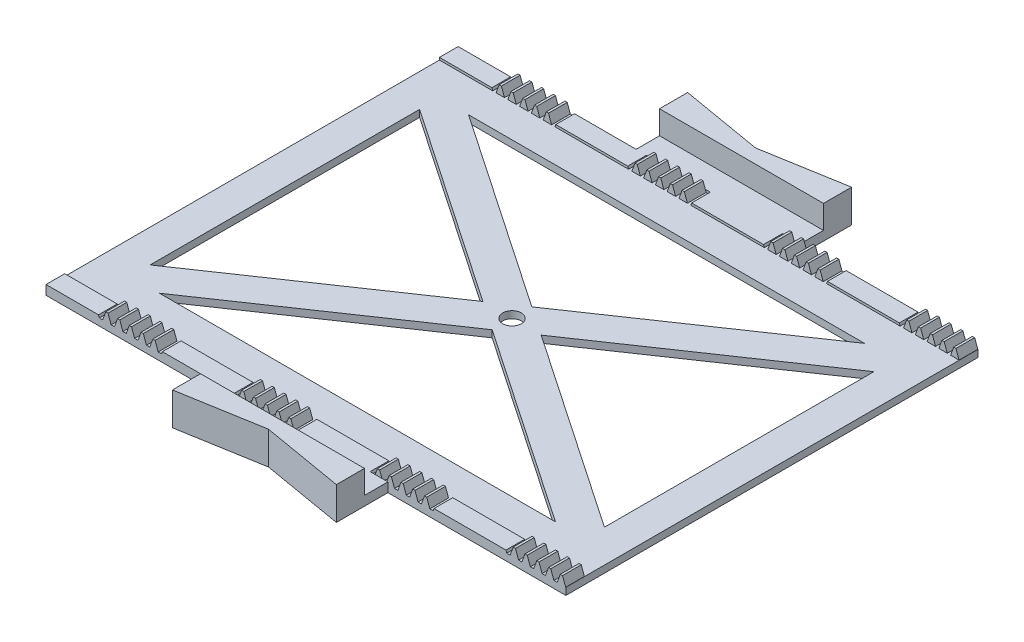
from build123d import *

# Parameters (mm, degrees)
BOSS_EXTRUDE1_DEPTH        = 2
SKETCH8_W                  = 12.566370614
SKETCH8_H                  = 1.3254
BOSS_EXTRUDE2_DEPTH        = 4
CUT_EXTRUDE1_DEPTH         = 4
LPATTERN1_COUNT            = 2
LPATTERN1_PITCH            = 2.513274123
LPATTERN1_COL_COUNT        = 5
LPATTERN1_COL_PITCH        = 2.513274123
MIRROR1_COPY_1_DEPTH       = 4
MIRROR1_COPY_2_DEPTH       = 4
MIRROR1_COPY_3_DEPTH       = 4
MIRROR1_COPY_4_DEPTH       = 4
MIRROR1_COPY_5_DEPTH       = 4
LPATTERN2_COUNT            = 4
LPATTERN2_PITCH            = 29
LPATTERN2_COPY_1_DEPTH     = 4
LPATTERN2_COPY_2_DEPTH     = 4
LPATTERN2_COPY_3_DEPTH     = 4
LPATTERN2_COPY_4_DEPTH     = 4
LPATTERN2_COPY_5_DEPTH     = 4
LPATTERN2_COPY_6_DEPTH     = 4
LPATTERN2_COPY_7_DEPTH     = 4
LPATTERN2_COPY_8_DEPTH     = 4
LPATTERN2_COPY_9_DEPTH     = 4
LPATTERN2_COPY_10_DEPTH    = 4
LPATTERN2_COPY_11_DEPTH    = 4
LPATTERN2_COPY_12_DEPTH    = 4
LPATTERN2_COPY_13_DEPTH    = 4
LPATTERN2_COPY_14_DEPTH    = 4
LPATTERN2_COPY_15_DEPTH    = 4
LPATTERN2_COPY_16_SKETCH_W = 12.566370614
LPATTERN2_COPY_16_SKETCH_H = 1.3254
LPATTERN2_COPY_16_DEPTH    = 4
LPATTERN2_COPY_17_SKETCH_W = 12.566370614
LPATTERN2_COPY_17_SKETCH_H = 1.3254
LPATTERN2_COPY_17_DEPTH    = 4
LPATTERN2_COPY_18_SKETCH_W = 12.566370614
LPATTERN2_COPY_18_SKETCH_H = 1.3254
LPATTERN2_COPY_18_DEPTH    = 4
LPATTERN2_COPY_19_DEPTH    = 4
LPATTERN2_COPY_20_DEPTH    = 4
LPATTERN2_COPY_21_DEPTH    = 4
LPATTERN2_COPY_22_DEPTH    = 4
LPATTERN2_COPY_23_DEPTH    = 4
LPATTERN2_COPY_24_DEPTH    = 4
LPATTERN2_COPY_25_DEPTH    = 4
LPATTERN2_COPY_26_DEPTH    = 4
LPATTERN2_COPY_27_DEPTH    = 4
LPATTERN2_COPY_28_DEPTH    = 4
LPATTERN2_COPY_29_DEPTH    = 4
LPATTERN2_COPY_30_DEPTH    = 4
LPATTERN2_COPY_31_DEPTH    = 4
LPATTERN2_COPY_32_DEPTH    = 4
LPATTERN2_COPY_33_DEPTH    = 4
LPATTERN2_COPY_34_DEPTH    = 4
LPATTERN2_COPY_35_DEPTH    = 4
LPATTERN2_COPY_36_DEPTH    = 4
SKETCH9_W                  = 111
SKETCH9_H                  = 80
CUT_EXTRUDE2_DEPTH         = 0.5
SKETCH10_R                 = 2
CUT_EXTRUDE3_DEPTH         = 75.05796436
BOSS_EXTRUDE3_DEPTH        = 7
SKETCH13_R                 = 4
CUT_EXTRUDE4_DEPTH         = 1
MIRROR4_COPY_1_SKETCH_R    = 4
MIRROR4_COPY_1_DEPTH       = 1


with BuildPart() as part:
    # Sketch1 → Boss-Extrude1 (new body)
    with BuildSketch(Plane(origin=(0, 0, 0), x_dir=(1, 0, 0), z_dir=(0, 1, 0))):
        Polygon((-17.5, -49), (-17.5, -44), (-55.5, -44), (-55.5, 44), (-17.5, 44), (-17.5, 49), (17.5, 49), (17.5, 44), (55.5, 44), (55.5, -44), (17.5, -44), (17.5, -49), align=None)
    extrude(amount=BOSS_EXTRUDE1_DEPTH)

    # Sketch8 → Boss-Extrude2 (add)
    with BuildSketch(Plane.XY.offset(44)):
        with Locations((49.526548246, 2.6627)):
            Rectangle(SKETCH8_W, SKETCH8_H)
    boss_extrude2 = extrude(amount=-BOSS_EXTRUDE2_DEPTH)

    # Sketch7 → Cut-Extrude1 (cut)
    with BuildSketch(Plane.XY.offset(44)):
        Polygon((46.110985357, 1.5), (45.402288766, 1.5), (44.7378975, 3.3254), (46.775376623, 3.3254), align=None)
    cut_extrude1 = extrude(amount=-CUT_EXTRUDE1_DEPTH, mode=Mode.SUBTRACT)

    # LPattern1: Cut-Extrude1 ×2
    with Locations(*[(-i * LPATTERN1_PITCH, 0, 0) for i in range(1, LPATTERN1_COUNT)]):
        add(cut_extrude1, mode=Mode.SUBTRACT)

    # LPattern1 col: Cut-Extrude1 ×5
    with Locations(*[(i * LPATTERN1_COL_PITCH, 0, 0) for i in range(1, LPATTERN1_COL_COUNT)]):
        add(cut_extrude1, mode=Mode.SUBTRACT)

    # Mirror1: Boss-Extrude2, Cut-Extrude1 across plane
    add(boss_extrude2.mirror(Plane.XY))
    add(cut_extrude1.mirror(Plane.XY), mode=Mode.SUBTRACT)

    # Mirror1 copy 1 sketch → Mirror1 copy 1 (cut)
    with BuildSketch(Plane(origin=(-2.513274123, 0, -44), x_dir=(1, 0, 0), z_dir=(0, 0, -1))):
        Polygon((46.110985357, -1.5), (45.402288766, -1.5), (44.7378975, -3.3254), (46.775376623, -3.3254), align=None)
    extrude(amount=-MIRROR1_COPY_1_DEPTH, mode=Mode.SUBTRACT)

    # Mirror1 copy 2 sketch → Mirror1 copy 2 (cut)
    with BuildSketch(Plane(origin=(2.513274123, 0, -44), x_dir=(1, 0, 0), z_dir=(0, 0, -1))):
        Polygon((46.110985357, -1.5), (45.402288766, -1.5), (44.7378975, -3.3254), (46.775376623, -3.3254), align=None)
    extrude(amount=-MIRROR1_COPY_2_DEPTH, mode=Mode.SUBTRACT)

    # Mirror1 copy 3 sketch → Mirror1 copy 3 (cut)
    with BuildSketch(Plane(origin=(5.026548246, 0, -44), x_dir=(1, 0, 0), z_dir=(0, 0, -1))):
        Polygon((46.110985357, -1.5), (45.402288766, -1.5), (44.7378975, -3.3254), (46.775376623, -3.3254), align=None)
    extrude(amount=-MIRROR1_COPY_3_DEPTH, mode=Mode.SUBTRACT)

    # Mirror1 copy 4 sketch → Mirror1 copy 4 (cut)
    with BuildSketch(Plane(origin=(7.539822369, 0, -44), x_dir=(1, 0, 0), z_dir=(0, 0, -1))):
        Polygon((46.110985357, -1.5), (45.402288766, -1.5), (44.7378975, -3.3254), (46.775376623, -3.3254), align=None)
    extrude(amount=-MIRROR1_COPY_4_DEPTH, mode=Mode.SUBTRACT)

    # Mirror1 copy 5 sketch → Mirror1 copy 5 (cut)
    with BuildSketch(Plane(origin=(10.053096491, 0, -44), x_dir=(1, 0, 0), z_dir=(0, 0, -1))):
        Polygon((46.110985357, -1.5), (45.402288766, -1.5), (44.7378975, -3.3254), (46.775376623, -3.3254), align=None)
    extrude(amount=-MIRROR1_COPY_5_DEPTH, mode=Mode.SUBTRACT)

    # LPattern2: Boss-Extrude2, Cut-Extrude1 ×4
    with Locations(*[(-i * LPATTERN2_PITCH, 0, 0) for i in range(1, LPATTERN2_COUNT)]):
        add(boss_extrude2)
        add(cut_extrude1, mode=Mode.SUBTRACT)

    # LPattern2 copy 1 sketch → LPattern2 copy 1 (cut)
    with BuildSketch(Plane(origin=(-31.513274123, 0, 44), x_dir=(1, 0, 0), z_dir=(0, 0, 1))):
        Polygon((46.110985357, 1.5), (45.402288766, 1.5), (44.7378975, 3.3254), (46.775376623, 3.3254), align=None)
    extrude(amount=-LPATTERN2_COPY_1_DEPTH, mode=Mode.SUBTRACT)

    # LPattern2 copy 2 sketch → LPattern2 copy 2 (cut)
    with BuildSketch(Plane(origin=(-60.513274123, 0, 44), x_dir=(1, 0, 0), z_dir=(0, 0, 1))):
        Polygon((46.110985357, 1.5), (45.402288766, 1.5), (44.7378975, 3.3254), (46.775376623, 3.3254), align=None)
    extrude(amount=-LPATTERN2_COPY_2_DEPTH, mode=Mode.SUBTRACT)

    # LPattern2 copy 3 sketch → LPattern2 copy 3 (cut)
    with BuildSketch(Plane(origin=(-89.513274123, 0, 44), x_dir=(1, 0, 0), z_dir=(0, 0, 1))):
        Polygon((46.110985357, 1.5), (45.402288766, 1.5), (44.7378975, 3.3254), (46.775376623, 3.3254), align=None)
    extrude(amount=-LPATTERN2_COPY_3_DEPTH, mode=Mode.SUBTRACT)

    # LPattern2 copy 4 sketch → LPattern2 copy 4 (cut)
    with BuildSketch(Plane(origin=(-26.486725877, 0, 44), x_dir=(1, 0, 0), z_dir=(0, 0, 1))):
        Polygon((46.110985357, 1.5), (45.402288766, 1.5), (44.7378975, 3.3254), (46.775376623, 3.3254), align=None)
    extrude(amount=-LPATTERN2_COPY_4_DEPTH, mode=Mode.SUBTRACT)

    # LPattern2 copy 5 sketch → LPattern2 copy 5 (cut)
    with BuildSketch(Plane(origin=(-55.486725877, 0, 44), x_dir=(1, 0, 0), z_dir=(0, 0, 1))):
        Polygon((46.110985357, 1.5), (45.402288766, 1.5), (44.7378975, 3.3254), (46.775376623, 3.3254), align=None)
    extrude(amount=-LPATTERN2_COPY_5_DEPTH, mode=Mode.SUBTRACT)

    # LPattern2 copy 6 sketch → LPattern2 copy 6 (cut)
    with BuildSketch(Plane(origin=(-84.486725877, 0, 44), x_dir=(1, 0, 0), z_dir=(0, 0, 1))):
        Polygon((46.110985357, 1.5), (45.402288766, 1.5), (44.7378975, 3.3254), (46.775376623, 3.3254), align=None)
    extrude(amount=-LPATTERN2_COPY_6_DEPTH, mode=Mode.SUBTRACT)

    # LPattern2 copy 7 sketch → LPattern2 copy 7 (cut)
    with BuildSketch(Plane(origin=(-23.973451754, 0, 44), x_dir=(1, 0, 0), z_dir=(0, 0, 1))):
        Polygon((46.110985357, 1.5), (45.402288766, 1.5), (44.7378975, 3.3254), (46.775376623, 3.3254), align=None)
    extrude(amount=-LPATTERN2_COPY_7_DEPTH, mode=Mode.SUBTRACT)

    # LPattern2 copy 8 sketch → LPattern2 copy 8 (cut)
    with BuildSketch(Plane(origin=(-52.973451754, 0, 44), x_dir=(1, 0, 0), z_dir=(0, 0, 1))):
        Polygon((46.110985357, 1.5), (45.402288766, 1.5), (44.7378975, 3.3254), (46.775376623, 3.3254), align=None)
    extrude(amount=-LPATTERN2_COPY_8_DEPTH, mode=Mode.SUBTRACT)

    # LPattern2 copy 9 sketch → LPattern2 copy 9 (cut)
    with BuildSketch(Plane(origin=(-81.973451754, 0, 44), x_dir=(1, 0, 0), z_dir=(0, 0, 1))):
        Polygon((46.110985357, 1.5), (45.402288766, 1.5), (44.7378975, 3.3254), (46.775376623, 3.3254), align=None)
    extrude(amount=-LPATTERN2_COPY_9_DEPTH, mode=Mode.SUBTRACT)

    # LPattern2 copy 10 sketch → LPattern2 copy 10 (cut)
    with BuildSketch(Plane(origin=(-21.460177631, 0, 44), x_dir=(1, 0, 0), z_dir=(0, 0, 1))):
        Polygon((46.110985357, 1.5), (45.402288766, 1.5), (44.7378975, 3.3254), (46.775376623, 3.3254), align=None)
    extrude(amount=-LPATTERN2_COPY_10_DEPTH, mode=Mode.SUBTRACT)

    # LPattern2 copy 11 sketch → LPattern2 copy 11 (cut)
    with BuildSketch(Plane(origin=(-50.460177631, 0, 44), x_dir=(1, 0, 0), z_dir=(0, 0, 1))):
        Polygon((46.110985357, 1.5), (45.402288766, 1.5), (44.7378975, 3.3254), (46.775376623, 3.3254), align=None)
    extrude(amount=-LPATTERN2_COPY_11_DEPTH, mode=Mode.SUBTRACT)

    # LPattern2 copy 12 sketch → LPattern2 copy 12 (cut)
    with BuildSketch(Plane(origin=(-79.460177631, 0, 44), x_dir=(1, 0, 0), z_dir=(0, 0, 1))):
        Polygon((46.110985357, 1.5), (45.402288766, 1.5), (44.7378975, 3.3254), (46.775376623, 3.3254), align=None)
    extrude(amount=-LPATTERN2_COPY_12_DEPTH, mode=Mode.SUBTRACT)

    # LPattern2 copy 13 sketch → LPattern2 copy 13 (cut)
    with BuildSketch(Plane(origin=(-18.946903509, 0, 44), x_dir=(1, 0, 0), z_dir=(0, 0, 1))):
        Polygon((46.110985357, 1.5), (45.402288766, 1.5), (44.7378975, 3.3254), (46.775376623, 3.3254), align=None)
    extrude(amount=-LPATTERN2_COPY_13_DEPTH, mode=Mode.SUBTRACT)

    # LPattern2 copy 14 sketch → LPattern2 copy 14 (cut)
    with BuildSketch(Plane(origin=(-47.946903509, 0, 44), x_dir=(1, 0, 0), z_dir=(0, 0, 1))):
        Polygon((46.110985357, 1.5), (45.402288766, 1.5), (44.7378975, 3.3254), (46.775376623, 3.3254), align=None)
    extrude(amount=-LPATTERN2_COPY_14_DEPTH, mode=Mode.SUBTRACT)

    # LPattern2 copy 15 sketch → LPattern2 copy 15 (cut)
    with BuildSketch(Plane(origin=(-76.946903509, 0, 44), x_dir=(1, 0, 0), z_dir=(0, 0, 1))):
        Polygon((46.110985357, 1.5), (45.402288766, 1.5), (44.7378975, 3.3254), (46.775376623, 3.3254), align=None)
    extrude(amount=-LPATTERN2_COPY_15_DEPTH, mode=Mode.SUBTRACT)

    # LPattern2 copy 16 sketch → LPattern2 copy 16 (add)
    with BuildSketch(Plane(origin=(-29, 0, -44), x_dir=(1, 0, 0), z_dir=(0, 0, -1))):
        with Locations((49.526548246, -2.6627)):
            Rectangle(LPATTERN2_COPY_16_SKETCH_W, LPATTERN2_COPY_16_SKETCH_H)
    extrude(amount=-LPATTERN2_COPY_16_DEPTH)

    # LPattern2 copy 17 sketch → LPattern2 copy 17 (add)
    with BuildSketch(Plane(origin=(-58, 0, -44), x_dir=(1, 0, 0), z_dir=(0, 0, -1))):
        with Locations((49.526548246, -2.6627)):
            Rectangle(LPATTERN2_COPY_17_SKETCH_W, LPATTERN2_COPY_17_SKETCH_H)
    extrude(amount=-LPATTERN2_COPY_17_DEPTH)

    # LPattern2 copy 18 sketch → LPattern2 copy 18 (add)
    with BuildSketch(Plane(origin=(-87, 0, -44), x_dir=(1, 0, 0), z_dir=(0, 0, -1))):
        with Locations((49.526548246, -2.6627)):
            Rectangle(LPATTERN2_COPY_18_SKETCH_W, LPATTERN2_COPY_18_SKETCH_H)
    extrude(amount=-LPATTERN2_COPY_18_DEPTH)

    # LPattern2 copy 19 sketch → LPattern2 copy 19 (cut)
    with BuildSketch(Plane(origin=(-29, 0, -44), x_dir=(1, 0, 0), z_dir=(0, 0, -1))):
        Polygon((46.110985357, -1.5), (45.402288766, -1.5), (44.7378975, -3.3254), (46.775376623, -3.3254), align=None)
    extrude(amount=-LPATTERN2_COPY_19_DEPTH, mode=Mode.SUBTRACT)

    # LPattern2 copy 20 sketch → LPattern2 copy 20 (cut)
    with BuildSketch(Plane(origin=(-58, 0, -44), x_dir=(1, 0, 0), z_dir=(0, 0, -1))):
        Polygon((46.110985357, -1.5), (45.402288766, -1.5), (44.7378975, -3.3254), (46.775376623, -3.3254), align=None)
    extrude(amount=-LPATTERN2_COPY_20_DEPTH, mode=Mode.SUBTRACT)

    # LPattern2 copy 21 sketch → LPattern2 copy 21 (cut)
    with BuildSketch(Plane(origin=(-87, 0, -44), x_dir=(1, 0, 0), z_dir=(0, 0, -1))):
        Polygon((46.110985357, -1.5), (45.402288766, -1.5), (44.7378975, -3.3254), (46.775376623, -3.3254), align=None)
    extrude(amount=-LPATTERN2_COPY_21_DEPTH, mode=Mode.SUBTRACT)

    # LPattern2 copy 22 sketch → LPattern2 copy 22 (cut)
    with BuildSketch(Plane(origin=(-31.513274123, 0, -44), x_dir=(1, 0, 0), z_dir=(0, 0, -1))):
        Polygon((46.110985357, -1.5), (45.402288766, -1.5), (44.7378975, -3.3254), (46.775376623, -3.3254), align=None)
    extrude(amount=-LPATTERN2_COPY_22_DEPTH, mode=Mode.SUBTRACT)

    # LPattern2 copy 23 sketch → LPattern2 copy 23 (cut)
    with BuildSketch(Plane(origin=(-60.513274123, 0, -44), x_dir=(1, 0, 0), z_dir=(0, 0, -1))):
        Polygon((46.110985357, -1.5), (45.402288766, -1.5), (44.7378975, -3.3254), (46.775376623, -3.3254), align=None)
    extrude(amount=-LPATTERN2_COPY_23_DEPTH, mode=Mode.SUBTRACT)

    # LPattern2 copy 24 sketch → LPattern2 copy 24 (cut)
    with BuildSketch(Plane(origin=(-89.513274123, 0, -44), x_dir=(1, 0, 0), z_dir=(0, 0, -1))):
        Polygon((46.110985357, -1.5), (45.402288766, -1.5), (44.7378975, -3.3254), (46.775376623, -3.3254), align=None)
    extrude(amount=-LPATTERN2_COPY_24_DEPTH, mode=Mode.SUBTRACT)

    # LPattern2 copy 25 sketch → LPattern2 copy 25 (cut)
    with BuildSketch(Plane(origin=(-26.486725877, 0, -44), x_dir=(1, 0, 0), z_dir=(0, 0, -1))):
        Polygon((46.110985357, -1.5), (45.402288766, -1.5), (44.7378975, -3.3254), (46.775376623, -3.3254), align=None)
    extrude(amount=-LPATTERN2_COPY_25_DEPTH, mode=Mode.SUBTRACT)

    # LPattern2 copy 26 sketch → LPattern2 copy 26 (cut)
    with BuildSketch(Plane(origin=(-55.486725877, 0, -44), x_dir=(1, 0, 0), z_dir=(0, 0, -1))):
        Polygon((46.110985357, -1.5), (45.402288766, -1.5), (44.7378975, -3.3254), (46.775376623, -3.3254), align=None)
    extrude(amount=-LPATTERN2_COPY_26_DEPTH, mode=Mode.SUBTRACT)

    # LPattern2 copy 27 sketch → LPattern2 copy 27 (cut)
    with BuildSketch(Plane(origin=(-84.486725877, 0, -44), x_dir=(1, 0, 0), z_dir=(0, 0, -1))):
        Polygon((46.110985357, -1.5), (45.402288766, -1.5), (44.7378975, -3.3254), (46.775376623, -3.3254), align=None)
    extrude(amount=-LPATTERN2_COPY_27_DEPTH, mode=Mode.SUBTRACT)

    # LPattern2 copy 28 sketch → LPattern2 copy 28 (cut)
    with BuildSketch(Plane(origin=(-23.973451754, 0, -44), x_dir=(1, 0, 0), z_dir=(0, 0, -1))):
        Polygon((46.110985357, -1.5), (45.402288766, -1.5), (44.7378975, -3.3254), (46.775376623, -3.3254), align=None)
    extrude(amount=-LPATTERN2_COPY_28_DEPTH, mode=Mode.SUBTRACT)

    # LPattern2 copy 29 sketch → LPattern2 copy 29 (cut)
    with BuildSketch(Plane(origin=(-52.973451754, 0, -44), x_dir=(1, 0, 0), z_dir=(0, 0, -1))):
        Polygon((46.110985357, -1.5), (45.402288766, -1.5), (44.7378975, -3.3254), (46.775376623, -3.3254), align=None)
    extrude(amount=-LPATTERN2_COPY_29_DEPTH, mode=Mode.SUBTRACT)

    # LPattern2 copy 30 sketch → LPattern2 copy 30 (cut)
    with BuildSketch(Plane(origin=(-81.973451754, 0, -44), x_dir=(1, 0, 0), z_dir=(0, 0, -1))):
        Polygon((46.110985357, -1.5), (45.402288766, -1.5), (44.7378975, -3.3254), (46.775376623, -3.3254), align=None)
    extrude(amount=-LPATTERN2_COPY_30_DEPTH, mode=Mode.SUBTRACT)

    # LPattern2 copy 31 sketch → LPattern2 copy 31 (cut)
    with BuildSketch(Plane(origin=(-21.460177631, 0, -44), x_dir=(1, 0, 0), z_dir=(0, 0, -1))):
        Polygon((46.110985357, -1.5), (45.402288766, -1.5), (44.7378975, -3.3254), (46.775376623, -3.3254), align=None)
    extrude(amount=-LPATTERN2_COPY_31_DEPTH, mode=Mode.SUBTRACT)

    # LPattern2 copy 32 sketch → LPattern2 copy 32 (cut)
    with BuildSketch(Plane(origin=(-50.460177631, 0, -44), x_dir=(1, 0, 0), z_dir=(0, 0, -1))):
        Polygon((46.110985357, -1.5), (45.402288766, -1.5), (44.7378975, -3.3254), (46.775376623, -3.3254), align=None)
    extrude(amount=-LPATTERN2_COPY_32_DEPTH, mode=Mode.SUBTRACT)

    # LPattern2 copy 33 sketch → LPattern2 copy 33 (cut)
    with BuildSketch(Plane(origin=(-79.460177631, 0, -44), x_dir=(1, 0, 0), z_dir=(0, 0, -1))):
        Polygon((46.110985357, -1.5), (45.402288766, -1.5), (44.7378975, -3.3254), (46.775376623, -3.3254), align=None)
    extrude(amount=-LPATTERN2_COPY_33_DEPTH, mode=Mode.SUBTRACT)

    # LPattern2 copy 34 sketch → LPattern2 copy 34 (cut)
    with BuildSketch(Plane(origin=(-18.946903509, 0, -44), x_dir=(1, 0, 0), z_dir=(0, 0, -1))):
        Polygon((46.110985357, -1.5), (45.402288766, -1.5), (44.7378975, -3.3254), (46.775376623, -3.3254), align=None)
    extrude(amount=-LPATTERN2_COPY_34_DEPTH, mode=Mode.SUBTRACT)

    # LPattern2 copy 35 sketch → LPattern2 copy 35 (cut)
    with BuildSketch(Plane(origin=(-47.946903509, 0, -44), x_dir=(1, 0, 0), z_dir=(0, 0, -1))):
        Polygon((46.110985357, -1.5), (45.402288766, -1.5), (44.7378975, -3.3254), (46.775376623, -3.3254), align=None)
    extrude(amount=-LPATTERN2_COPY_35_DEPTH, mode=Mode.SUBTRACT)

    # LPattern2 copy 36 sketch → LPattern2 copy 36 (cut)
    with BuildSketch(Plane(origin=(-76.946903509, 0, -44), x_dir=(1, 0, 0), z_dir=(0, 0, -1))):
        Polygon((46.110985357, -1.5), (45.402288766, -1.5), (44.7378975, -3.3254), (46.775376623, -3.3254), align=None)
    extrude(amount=-LPATTERN2_COPY_36_DEPTH, mode=Mode.SUBTRACT)

    # Sketch9 → Cut-Extrude2 (cut)
    with BuildSketch(Plane(origin=(0, 2, 0), x_dir=(1, 0, 0), z_dir=(0, 1, 0))):
        Rectangle(SKETCH9_W, SKETCH9_H)
    extrude(amount=-CUT_EXTRUDE2_DEPTH, mode=Mode.SUBTRACT)

    # Sketch10 → Cut-Extrude3 (cut, through all)
    with BuildSketch(Plane(origin=(0, 1.5, 0), x_dir=(1, 0, 0), z_dir=(0, 1, 0))):
        Polygon((0, 4.233352358), (42.278254868, 33), (-42.278254868, 33), align=None)
        Polygon((-48.5, -28.766647642), (-6.221745132, 0), (-48.5, 28.766647642), align=None)
        Polygon((48.5, 28.766647642), (6.221745132, 0), (48.5, -28.766647642), align=None)
        Polygon((42.278254868, -33), (0, -4.233352358), (-42.278254868, -33), align=None)
        with Locations(Location((0, 0, 0), (0, 0, 270))):
            Circle(SKETCH10_R)
    extrude(amount=-CUT_EXTRUDE3_DEPTH, mode=Mode.SUBTRACT)

    # Sketch12 → Boss-Extrude3 (add)
    with BuildSketch(Plane(origin=(0, 0, 0), x_dir=(1, 0, 0), z_dir=(0, 1, 0))):
        Polygon((-17.5, -49), (-17.5, -55), (0, -52), (17.5, -55), (17.5, -49), align=None)
    boss_extrude3 = extrude(amount=BOSS_EXTRUDE3_DEPTH)

    # Mirror2: Boss-Extrude3 across plane
    add(boss_extrude3.mirror(Plane.XY))

    # Sketch13 → Cut-Extrude4 (cut)
    with BuildSketch(Plane.XZ):
        with Locations(Location((47.3, 36.3, 0), (0, 0, 270))):
            Circle(SKETCH13_R)
    cut_extrude4 = extrude(amount=-CUT_EXTRUDE4_DEPTH, mode=Mode.SUBTRACT)

    # Mirror3: Cut-Extrude4 across plane
    add(cut_extrude4.mirror(Plane.XY), mode=Mode.SUBTRACT)

    # Mirror4: Cut-Extrude4 across plane
    add(cut_extrude4.mirror(Plane(origin=(0, 0, 0), x_dir=(0, 0, 1), z_dir=(1, 0, 0))), mode=Mode.SUBTRACT)

    # Mirror4 copy 1 sketch → Mirror4 copy 1 (cut)
    with BuildSketch(Plane(origin=(0, 0, 0), x_dir=(-1, 0, 0), z_dir=(0, -1, 0))):
        with Locations(Location((47.3, 36.3, 0), (0, 0, 270))):
            Circle(MIRROR4_COPY_1_SKETCH_R)
    extrude(amount=-MIRROR4_COPY_1_DEPTH, mode=Mode.SUBTRACT)


solid = part.part
